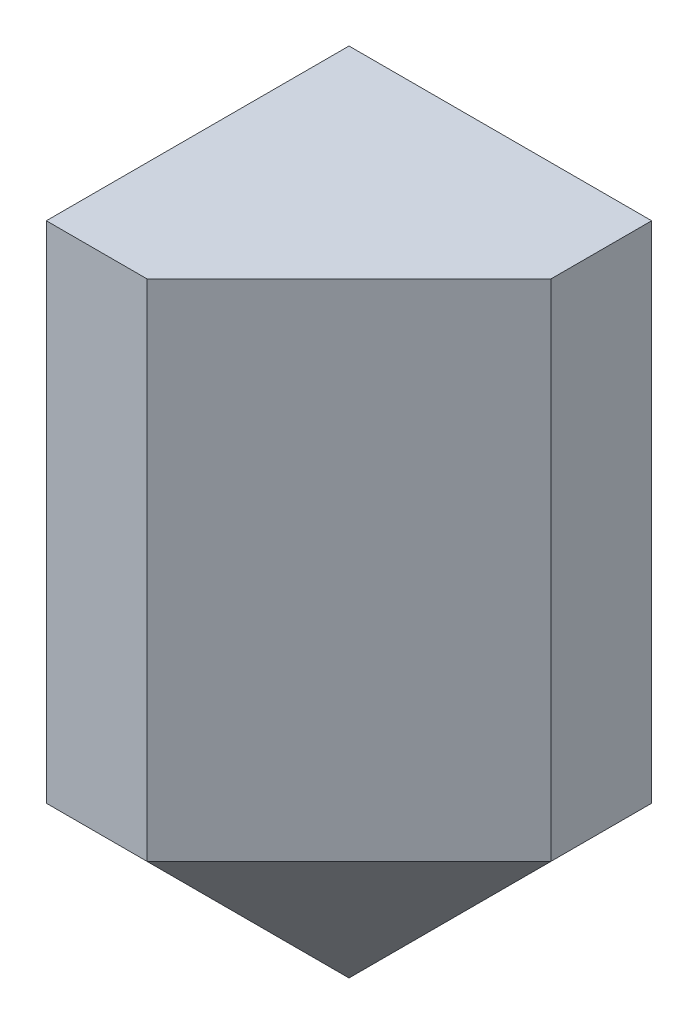
from build123d import *

# Parameters (mm, degrees)
SCHIZZO1_W                   = 30
SCHIZZO1_H                   = 40
ESTRUSIONE_ESTRUSIONE1_DEPTH = 30
SMUSSO1_SIZE                 = 20
ESTRUSIONE_ESTRUSIONE2_DEPTH = 30
FORO_PER_VITE_M5_1_D         = 5.5
FORO_PER_VITE_M5_1_DEPTH     = 13
FORO_PER_VITE_M5_1_TIP       = 1.652366702
FORO_PER_VITE_M5_2_D         = 5.5
FORO_PER_VITE_M5_2_DEPTH     = 13
FORO_PER_VITE_M5_2_TIP       = 1.652366702
SCHIZZO6_R                   = 7.5
TAGLIO_ESTRUSIONE1_DEPTH     = 3
FORO_PER_VITE_M4_1_D         = 4.5
FORO_PER_VITE_M4_1_DEPTH     = 10
FORO_PER_VITE_M4_1_TIP       = 1.351936393


with BuildPart() as part:
    # Schizzo1 → Estrusione-Estrusione1 (new body)
    with BuildSketch(Plane.XY):
        with Locations((15, 20)):
            Rectangle(SCHIZZO1_W, SCHIZZO1_H)
    extrude(amount=ESTRUSIONE_ESTRUSIONE1_DEPTH)

    # Smusso1
    smusso1_edges = [part.edges().sort_by_distance(p)[0] for p in [
        (30, 20, 30),
        (30, 0, 15),
        (15, 0, 30),
    ]]
    chamfer(smusso1_edges, length=SMUSSO1_SIZE)

    # Schizzo2 → Estrusione-Estrusione2 (add)
    with BuildSketch(Plane(origin=(0, 40, 0), x_dir=(1, 0, 0), z_dir=(0, 1, 0))):
        Polygon((0, 0), (30, 0), (30, -10), (10, -30), (0, -30), align=None)
    extrude(amount=ESTRUSIONE_ESTRUSIONE2_DEPTH)

    # Foro per Vite M5-1
    with Locations(Plane.ZY):
        with Locations((14, 20), (14, 48)):
            Hole(FORO_PER_VITE_M5_1_D / 2, depth=FORO_PER_VITE_M5_1_DEPTH)
            with Locations((0, 0, -(FORO_PER_VITE_M5_1_DEPTH + FORO_PER_VITE_M5_1_TIP / 2))):  # 118° drill point
                Cone(0, FORO_PER_VITE_M5_1_D / 2, FORO_PER_VITE_M5_1_TIP, mode=Mode.SUBTRACT)

    # Foro per Vite M5-2
    with Locations(Plane(origin=(18, 20, 0), x_dir=(-1, 0, 0), z_dir=(0, 0, -1))):
        with Locations((0, 0)):
            Hole(FORO_PER_VITE_M5_2_D / 2, depth=FORO_PER_VITE_M5_2_DEPTH)
            with Locations((0, 0, -(FORO_PER_VITE_M5_2_DEPTH + FORO_PER_VITE_M5_2_TIP / 2))):  # 118° drill point
                Cone(0, FORO_PER_VITE_M5_2_D / 2, FORO_PER_VITE_M5_2_TIP, mode=Mode.SUBTRACT)

    # Schizzo6 → Taglio-Estrusione1 (cut)
    with BuildSketch(Plane(origin=(0, 0, 0), x_dir=(-1, 0, 0), z_dir=(0, 0, -1))):
        with Locations((-15, 55)):
            Circle(SCHIZZO6_R)
    extrude(amount=-TAGLIO_ESTRUSIONE1_DEPTH, mode=Mode.SUBTRACT)

    # Foro per Vite M4-1
    with Locations(Plane(origin=(0, 0, 3), x_dir=(-1, 0, 0), z_dir=(0, 0, -1))):
        with Locations((-15, 55)):
            Hole(FORO_PER_VITE_M4_1_D / 2, depth=FORO_PER_VITE_M4_1_DEPTH)
            with Locations((0, 0, -(FORO_PER_VITE_M4_1_DEPTH + FORO_PER_VITE_M4_1_TIP / 2))):  # 118° drill point
                Cone(0, FORO_PER_VITE_M4_1_D / 2, FORO_PER_VITE_M4_1_TIP, mode=Mode.SUBTRACT)


solid = part.part
